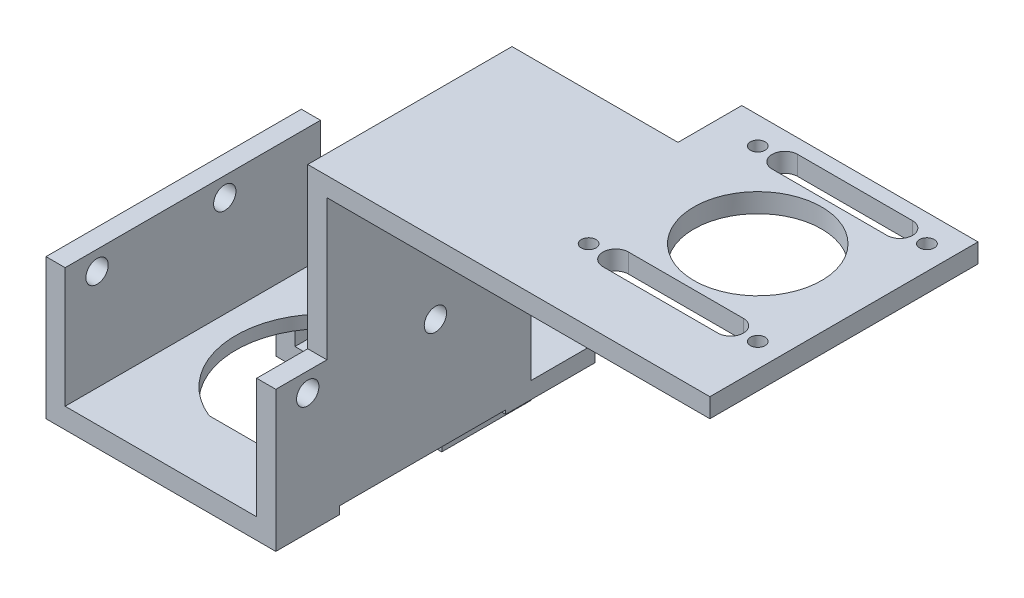
from build123d import *

# Parameters (mm, degrees)
SKETCH_1_W            = 36
SKETCH_1_H            = 40
EXTRUDE_1_DEPTH       = 3
SKETCH_2_W            = 3
SKETCH_2_H            = 40
EXTRUDE_2_DEPTH       = 18.8
SKETCH_3_R            = 14
CUT_EXTRUDE_1_DEPTH   = 9
SKETCH_4_W            = 36
SKETCH_4_H            = 3
EXTRUDE_3_DEPTH       = 10
SKETCH_6_R            = 2.7
CUT_EXTRUDE_3_DEPTH   = 10
SKETCH_7_R            = 1.75
CUT_EXTRUDE_4_DEPTH   = 52.68404009
SKETCH_9_W            = 25
SKETCH_9_H            = 3
SKETCH_9_W_2          = 3
SKETCH_9_H_2          = 9.3
EXTRUDE_4_DEPTH       = 20
CHAMFER_1_SIZE        = 5
CUT_EXTRUDE_START     = -30
SKETCH_10_R           = 2.7
CUT_EXTRUDE_5_DEPTH   = 30
SKETCH_11_W           = 40.05397725
SKETCH_11_H           = 18.071111192
CUT_EXTRUDE_6_DEPTH   = 52.68404009
EXTRUDE_START         = 2.5
SKETCH_12_W           = 36
SKETCH_12_H           = 20
SKETCH_12_R           = 2.7
EXTRUDE_5_DEPTH       = 2.5
SKETCH_13_W           = 62.12277329
SKETCH_13_H           = 35.561448302
CUT_EXTRUDE_7_DEPTH   = 1
SKETCH_16_W           = 60
SKETCH_16_H           = 3
SKETCH_16_W_2         = 3
SKETCH_16_H_2         = 25
EXTRUDE_7_DEPTH       = 65
EXTRUDE_START_2       = 8
EXTRUDE_8_DEPTH       = 8
SKETCH_18_R           = 1.15
SKETCH_18_R_2         = 10
CUT_EXTRUDE_8_DEPTH   = 15
SKETCH_19_W           = 125.229267156
SKETCH_19_H           = 103.922898786
CUT_EXTRUDE_9_DEPTH   = 0.5
SKETCH_20_W           = 154.797288569
SKETCH_20_H           = 90.443359613
CUT_EXTRUDE_10_DEPTH  = 1.8
SKETCH_21_W           = 11.155684717
SKETCH_21_H           = 2.603751016
EXTRUDE_9_DEPTH       = 3
EXTRUDE_10_DEPTH      = 10
EXTRUDE_10_DEPTH_BACK = 4
SKETCH_22_W           = 36
SKETCH_22_H           = 3.2
SKETCH_23_R           = 1.75
CUT_EXTRUDE_12_DEPTH  = 10
SKETCH_26_W           = 12.845915964
SKETCH_26_H           = 7.377373426
EXTRUDE_11_DEPTH      = 3.2
SKETCH_27_W           = 116.42408431
SKETCH_27_H           = 62.505927617
CUT_EXTRUDE_13_DEPTH  = 10
SKETCH_29_W           = 89.791123847
SKETCH_29_H           = 12.28472202
SKETCH_29_W_2         = 107.401489541
SKETCH_29_H_2         = 29.785433334
CUT_EXTRUDE_14_DEPTH  = 25
SKETCH_30_W           = 3
SKETCH_30_H           = 18.8
EXTRUDE_12_DEPTH      = 17
SKETCH_31_W           = 80.768529078
SKETCH_31_H           = 45.765209612
CUT_EXTRUDE_15_DEPTH  = 0.6
SKETCH_32_W           = 23
SKETCH_32_H           = 2.8
SKETCH_32_W_2         = 3
SKETCH_32_H_2         = 9.9
EXTRUDE_13_DEPTH      = 14
SKETCH_34_R           = 1.75
CUT_EXTRUDE_17_DEPTH  = 97.806198149
SKETCH_35_W           = 168.711651586
SKETCH_35_H           = 128.925269833
CUT_EXTRUDE_18_DEPTH  = 7
SKETCH_36_W           = 30.780953922
SKETCH_36_H           = 20.383466973
CUT_EXTRUDE_19_DEPTH  = 43.8


with BuildPart() as part:
    # 草图1 → 凸台-拉伸1 (new body)
    with BuildSketch(Plane(origin=(0, 0, 0), x_dir=(1, 0, 0), z_dir=(0, 1, 0))):
        Rectangle(SKETCH_1_W, SKETCH_1_H)
    extrude(amount=EXTRUDE_1_DEPTH)

    # 草图2 → 凸台-拉伸2 (add)
    with BuildSketch(Plane(origin=(0, 3, 0), x_dir=(1, 0, 0), z_dir=(0, 1, 0))):
        with Locations((-16.5, 0)):
            Rectangle(SKETCH_2_W, SKETCH_2_H)
        with Locations((16.5, 0)):
            Rectangle(SKETCH_2_W, SKETCH_2_H)
    extrude(amount=EXTRUDE_2_DEPTH)

    # 草图3 → 切除-拉伸1 (cut)
    with BuildSketch(Plane(origin=(0, 0, 0), x_dir=(-1, 0, 0), z_dir=(0, -1, 0))):
        with Locations(Location((-2.75, 3.000025, 0), (0, 0, 90))):
            Circle(SKETCH_3_R)
    extrude(amount=-CUT_EXTRUDE_1_DEPTH, mode=Mode.SUBTRACT)

    # 草图4 → 凸台-拉伸3 (add)
    with BuildSketch(Plane.XY.offset(20)):
        with Locations((0, 1.5)):
            Rectangle(SKETCH_4_W, SKETCH_4_H)
    extrude(amount=EXTRUDE_3_DEPTH)

    # 草图6 → 切除-拉伸3 (cut)
    with BuildSketch(Plane(origin=(0, 0, 0), x_dir=(-1, 0, 0), z_dir=(0, -1, 0))):
        with Locations(Location((-2.75, -16.149975, 0), (0, 0, 90))):
            Circle(SKETCH_6_R)
    extrude(amount=-CUT_EXTRUDE_3_DEPTH, mode=Mode.SUBTRACT)

    # 草图7 → 切除-拉伸4 (cut, through all)
    with BuildSketch(Plane.ZY.offset(18)):
        with Locations((15, 18.8)):
            Circle(SKETCH_7_R)
        with Locations((-5, 18.8)):
            Circle(SKETCH_7_R)
    extrude(amount=-CUT_EXTRUDE_4_DEPTH, mode=Mode.SUBTRACT)

    # 草图9 → 凸台-拉伸4 (add)
    with BuildSketch(Plane.XY.offset(30)):
        with Locations((-2.5, -7.8)):
            Rectangle(SKETCH_9_W, SKETCH_9_H)
        with Locations((-16.5, -4.65)):
            Rectangle(SKETCH_9_W_2, SKETCH_9_H_2)
    extrude(amount=-EXTRUDE_4_DEPTH)

    # 倒角1
    chamfer_1_edges = [part.edges().sort_by_distance(p)[0] for p in [
        (10, -7.8, 30),
    ]]
    chamfer(chamfer_1_edges, length=CHAMFER_1_SIZE)

    # 草图10 → 切除-拉伸5 (cut)
    with BuildSketch(Plane(origin=(0, 0, 0), x_dir=(1, 0, 0), z_dir=(0, 1, 0)).offset(CUT_EXTRUDE_START)):
        with Locations(Location((2.75, -16.149975, 0), (0, 0, 90))):
            Circle(SKETCH_10_R)
    extrude(amount=CUT_EXTRUDE_5_DEPTH, mode=Mode.SUBTRACT)

    # 草图11 → 切除-拉伸6 (cut, through all)
    with BuildSketch(Plane.ZY.offset(18)):
        with Locations((20.026988625, -9.035555596)):
            Rectangle(SKETCH_11_W, SKETCH_11_H)
    extrude(amount=-CUT_EXTRUDE_6_DEPTH, mode=Mode.SUBTRACT)

    # 草图12 → 凸台-拉伸5 (add)
    with BuildSketch(Plane(origin=(0, 0, 0), x_dir=(-1, 0, 0), z_dir=(0, -1, 0)).offset(EXTRUDE_START)):
        with Locations((0, -20)):
            Rectangle(SKETCH_12_W, SKETCH_12_H)
        with Locations(Location((-2.75, -16.149975, 0), (0, 0, 90))):
            Circle(SKETCH_12_R, mode=Mode.SUBTRACT)
    extrude(amount=-EXTRUDE_5_DEPTH)

    # 草图13 → 切除-拉伸7 (cut)
    with BuildSketch(Plane(origin=(0, 0, 0), x_dir=(-1, 0, 0), z_dir=(0, -1, 0))):
        with Locations((0.086945799, 7.780724151)):
            Rectangle(SKETCH_13_W, SKETCH_13_H)
    extrude(amount=-CUT_EXTRUDE_7_DEPTH, mode=Mode.SUBTRACT)

    # 草图16 → 凸台-拉伸7 (add)
    with BuildSketch(Plane.XY.offset(20)):
        with Locations((48, 45.3)):
            Rectangle(SKETCH_16_W, SKETCH_16_H)
        with Locations((16.5, 34.3)):
            Rectangle(SKETCH_16_W_2, SKETCH_16_H_2)
    extrude(amount=-EXTRUDE_7_DEPTH)

    # 草图17 → 凸台-拉伸8 (add)
    with BuildSketch(Plane(origin=(0, 9, 0), x_dir=(-1, 0, 0), z_dir=(0, -1, 0)).offset(EXTRUDE_START_2)):
        with BuildLine():
            Line((-15, -3.777695856), (-15, 9.777745856))
            ThreePointArc((-15, 9.777745856), (-16.75, 3.000025), (-15, -3.777695856))
        make_face()
    extrude(amount=-EXTRUDE_8_DEPTH)

    # 草图18 → 切除-拉伸8 (cut)
    with BuildSketch(Plane(origin=(0, 46.8, 0), x_dir=(1, 0, 0), z_dir=(0, 1, 0))):
        with Locations(Location((47.75, 25.75, 0), (0, 0, 270))):
            Circle(SKETCH_18_R)
        with Locations(Location((74.25, 25.75, 0), (0, 0, 270))):
            Circle(SKETCH_18_R)
        with Locations(Location((74.25, -0.75, 0), (0, 0, 270))):
            Circle(SKETCH_18_R)
        with Locations(Location((47.75, -0.75, 0), (0, 0, 270))):
            Circle(SKETCH_18_R)
        with Locations(Location((61, 12.5, 0), (0, 0, 270))):
            Circle(SKETCH_18_R_2)
        with BuildLine():
            Line((52, 27.75), (70, 27.75))
            ThreePointArc((70, 27.75), (72, 25.75), (70, 23.75))
            Line((70, 23.75), (52, 23.75))
            ThreePointArc((52, 23.75), (50, 25.75), (52, 27.75))
        make_face()
        with BuildLine():
            Line((52, -2.75), (70, -2.75))
            ThreePointArc((70, -2.75), (72, -0.75), (70, 1.25))
            Line((70, 1.25), (52, 1.25))
            ThreePointArc((52, 1.25), (50, -0.75), (52, -2.75))
        make_face()
    extrude(amount=-CUT_EXTRUDE_8_DEPTH, mode=Mode.SUBTRACT)

    # 草图19 → 切除-拉伸9 (cut)
    with BuildSketch(Plane(origin=(0, -2.5, 0), x_dir=(-1, 0, 0), z_dir=(0, -1, 0))):
        with Locations((5.272239112, -16.1971882)):
            Rectangle(SKETCH_19_W, SKETCH_19_H)
    extrude(amount=-CUT_EXTRUDE_9_DEPTH, mode=Mode.SUBTRACT)

    # 草图20 → 切除-拉伸10 (cut)
    with BuildSketch(Plane(origin=(0, -2, 0), x_dir=(-1, 0, 0), z_dir=(0, -1, 0))):
        with Locations((2.880707968, -7.718123237)):
            Rectangle(SKETCH_20_W, SKETCH_20_H)
    extrude(amount=-CUT_EXTRUDE_10_DEPTH, mode=Mode.SUBTRACT)

    # 草图21 → 凸台-拉伸9 (add)
    with BuildSketch(Plane(origin=(0, 0, 0), x_dir=(1, 0, 0), z_dir=(0, 1, 0))):
        with Locations((3.131752483, -11.301875508)):
            Rectangle(SKETCH_21_W, SKETCH_21_H)
    extrude(amount=EXTRUDE_9_DEPTH)

    # 草图22 → 凸台-拉伸10 (add, two sides: drawn at the far end of the back side and taken through both)
    with BuildSketch(Plane(origin=(0, 0, -20), x_dir=(-1, 0, 0), z_dir=(0, 0, -1)).offset(-EXTRUDE_10_DEPTH_BACK)):
        with Locations((0, 1.4)):
            Rectangle(SKETCH_22_W, SKETCH_22_H)
    extrude(amount=EXTRUDE_10_DEPTH + EXTRUDE_10_DEPTH_BACK)

    # 草图23 → 切除-拉伸12 (cut)
    with BuildSketch(Plane(origin=(0, 9, 0), x_dir=(-1, 0, 0), z_dir=(0, -1, 0))):
        with Locations(Location((-2.75, 22.150025, 0), (0, 0, 270))):
            Circle(SKETCH_23_R)
    extrude(amount=CUT_EXTRUDE_12_DEPTH, mode=Mode.SUBTRACT)

    # 草图26 → 凸台-拉伸11 (add, through all)
    with BuildSketch(Plane(origin=(0, 3, 0), x_dir=(1, 0, 0), z_dir=(0, 1, 0))):
        with Locations((3.420651678, -16.929062366)):
            Rectangle(SKETCH_26_W, SKETCH_26_H)
    extrude(amount=-EXTRUDE_11_DEPTH)

    # 草图27 → 切除-拉伸13 (cut)
    with BuildSketch(Plane.XY.offset(30)):
        with Locations((4.783062287, -2.648783639)):
            Rectangle(SKETCH_27_W, SKETCH_27_H)
    extrude(amount=-CUT_EXTRUDE_13_DEPTH, mode=Mode.SUBTRACT)

    # 草图29 → 切除-拉伸14 (cut)
    with BuildSketch(Plane(origin=(0, 46.8, 0), x_dir=(1, 0, 0), z_dir=(0, 1, 0))):
        with Locations((43.319325488, 43.14236101)):
            Rectangle(SKETCH_29_W, SKETCH_29_H)
        with Locations((56.472746777, -26.892716667)):
            Rectangle(SKETCH_29_W_2, SKETCH_29_H_2)
    extrude(amount=-CUT_EXTRUDE_14_DEPTH, mode=Mode.SUBTRACT)

    # 草图30 → 凸台-拉伸12 (add)
    with BuildSketch(Plane(origin=(0, 0, -20), x_dir=(-1, 0, 0), z_dir=(0, 0, -1))):
        with Locations((-16.5, 12.4)):
            Rectangle(SKETCH_30_W, SKETCH_30_H)
    extrude(amount=EXTRUDE_12_DEPTH)

    # 草图31 → 切除-拉伸15 (cut)
    with BuildSketch(Plane(origin=(0, -0.2, 0), x_dir=(-1, 0, 0), z_dir=(0, -1, 0))):
        with Locations((-3.369884793, 29.731080354)):
            Rectangle(SKETCH_31_W, SKETCH_31_H)
    extrude(amount=-CUT_EXTRUDE_15_DEPTH, mode=Mode.SUBTRACT)

    # 草图32 → 凸台-拉伸13 (add)
    with BuildSketch(Plane(origin=(0, 0, -30), x_dir=(-1, 0, 0), z_dir=(0, 0, -1))):
        with Locations((3.5, -8.3)):
            Rectangle(SKETCH_32_W, SKETCH_32_H)
        with Locations((16.5, -1.95)):
            Rectangle(SKETCH_32_W_2, SKETCH_32_H_2)
        with Locations((16.5, -8.3)):
            Rectangle(SKETCH_32_W_2, SKETCH_32_H)
    extrude(amount=-EXTRUDE_13_DEPTH)

    # 草图34 → 切除-拉伸17 (cut, through all)
    with BuildSketch(Plane(origin=(0, 3, 0), x_dir=(1, 0, 0), z_dir=(0, 1, 0))):
        with Locations(Location((2.75, 22.150025, 0), (0, 0, 270))):
            Circle(SKETCH_34_R)
    extrude(amount=-CUT_EXTRUDE_17_DEPTH, mode=Mode.SUBTRACT)

    # 草图35 → 切除-拉伸18 (cut)
    with BuildSketch(Plane(origin=(0, 0, -37), x_dir=(-1, 0, 0), z_dir=(0, 0, -1))):
        with Locations((-14.403539842, 2.608943066)):
            Rectangle(SKETCH_35_W, SKETCH_35_H)
    extrude(amount=-CUT_EXTRUDE_18_DEPTH, mode=Mode.SUBTRACT)

    # 草图36 → 切除-拉伸19 (cut)
    with BuildSketch(Plane(origin=(0, 46.8, 0), x_dir=(1, 0, 0), z_dir=(0, 1, 0))):
        with Locations((25.609523039, 30.191733487)):
            Rectangle(SKETCH_36_W, SKETCH_36_H)
    extrude(amount=-CUT_EXTRUDE_19_DEPTH, mode=Mode.SUBTRACT)


solid = part.part
